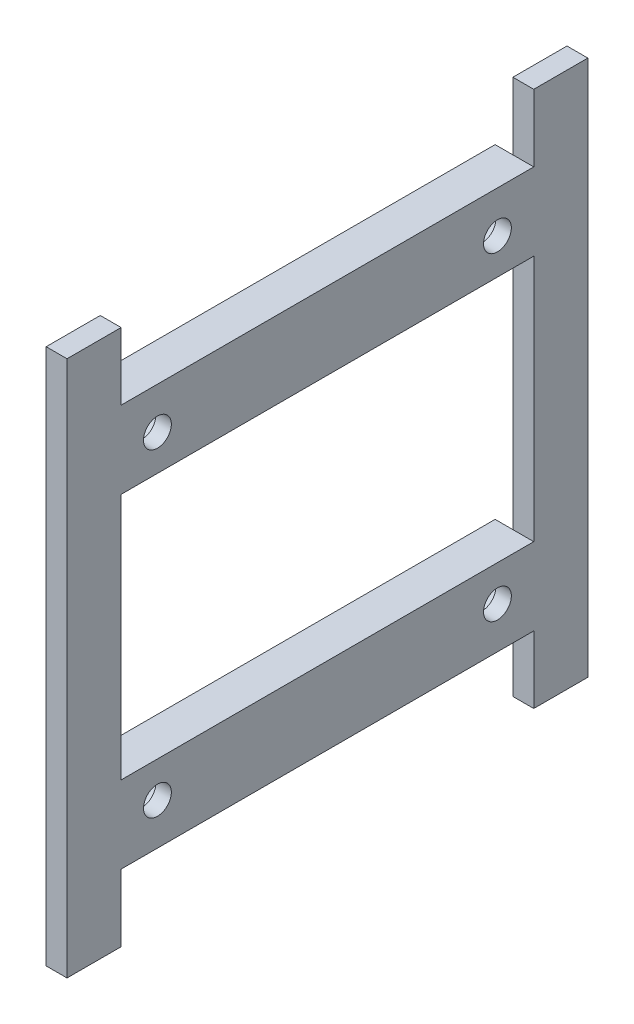
from build123d import *

# Parameters (mm, degrees)
SKETCH1_W             = 7
SKETCH1_H             = 69.4
BOSS_EXTRUDE1_DEPTH   = 2.7
BOSS_EXTRUDE1_2_DEPTH = 2.7
SKETCH1_7_W           = 53.4
SKETCH1_7_H           = 10
SKETCH1_7_R           = 1.8
BOSS_EXTRUDE2_DEPTH   = 5
SKETCH2_R             = 3.15
CUT_EXTRUDE1_DEPTH    = 3


with BuildPart() as part:
    # Sketch1 → Boss-Extrude1 (new body)
    with BuildSketch(Plane(origin=(0, 0, 0), x_dir=(0, 0, -1), z_dir=(1, 0, 0))):
        with Locations((-30.2, 0)):
            Rectangle(SKETCH1_W, SKETCH1_H)
    extrude(amount=-BOSS_EXTRUDE1_DEPTH)



with BuildPart() as body_2:
    # Sketch1 → Boss-Extrude1 2 (new body)
    with BuildSketch(Plane(origin=(0, 0, 0), x_dir=(0, 0, -1), z_dir=(1, 0, 0))):
        with Locations((30.2, 0)):
            Rectangle(SKETCH1_W, SKETCH1_H)
    extrude(amount=-BOSS_EXTRUDE1_2_DEPTH)


with BuildPart() as part_1:
    add(part.part)

    add(body_2.part)  # Boss-Extrude2 merges body 2
    # Sketch1<7> → Boss-Extrude2 (add)
    # profile 1 of 2: a face of its own
    with BuildSketch(Plane(origin=(0, 0, 0), x_dir=(0, 0, -1), z_dir=(1, 0, 0))):
        with Locations((0, 21)):
            Rectangle(SKETCH1_7_W, SKETCH1_7_H)
        with Locations((-22, 20.625876568)):
            Circle(SKETCH1_7_R, mode=Mode.SUBTRACT)
        with Locations((22, 20.625876568)):
            Circle(SKETCH1_7_R, mode=Mode.SUBTRACT)
    # profile 2 of 2: a face of its own
    with BuildSketch(Plane(origin=(0, 0, 0), x_dir=(0, 0, -1), z_dir=(1, 0, 0))):
        with Locations((0, -21)):
            Rectangle(SKETCH1_7_W, SKETCH1_7_H)
        with Locations((22, -20.625876568)):
            Circle(SKETCH1_7_R, mode=Mode.SUBTRACT)
        with Locations((-22, -20.625876568)):
            Circle(SKETCH1_7_R, mode=Mode.SUBTRACT)
    extrude(amount=-BOSS_EXTRUDE2_DEPTH)

    # Sketch2 → Cut-Extrude1 (cut)
    with BuildSketch(Plane.ZY.offset(5)):
        with Locations((-22, 20.625876568)):
            Circle(SKETCH2_R)
        with Locations((22, 20.625876568)):
            Circle(SKETCH2_R)
        with Locations((-22, -20.625876568)):
            Circle(SKETCH2_R)
        with Locations((22, -20.625876568)):
            Circle(SKETCH2_R)
    extrude(amount=-CUT_EXTRUDE1_DEPTH, mode=Mode.SUBTRACT)


solid = part_1.part
